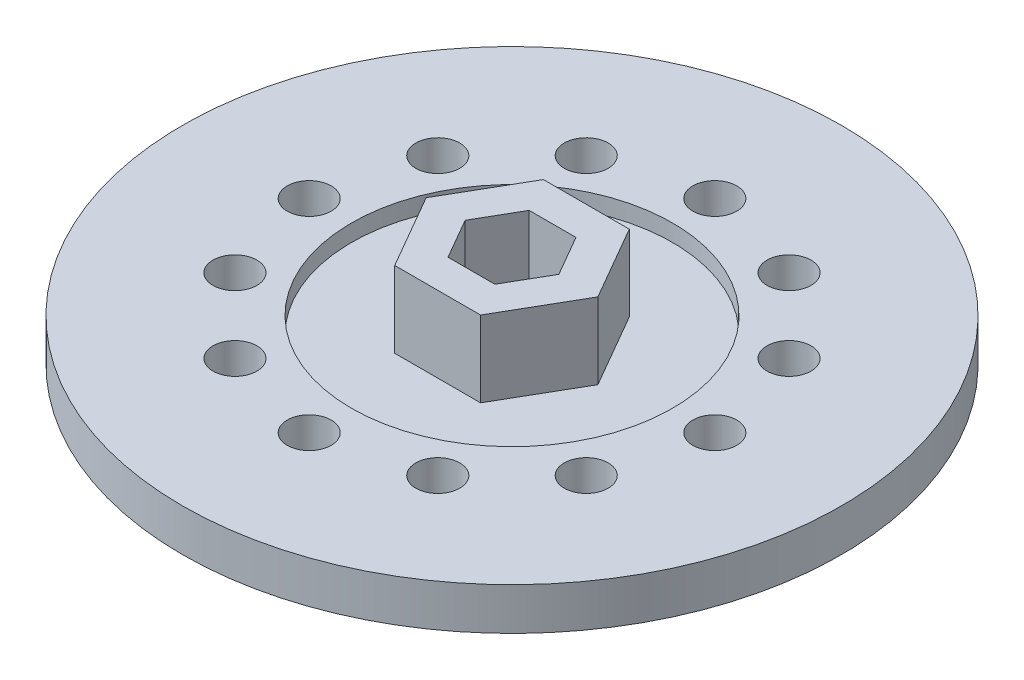
from build123d import *

# Parameters (mm, degrees)
SKETCH1_R           = 49.53
BOSS_EXTRUDE1_DEPTH = 15.24
HEX_HOLE_DEPTH      = 13.97
SKETCH5_R           = 4.191
CENTERHOLE_DEPTH    = 72.425504548
SKETCH6_R           = 39.37
CUT_EXTRUDE1_DEPTH  = 11.43
SKETCH7_R           = 3.302
CUT_EXTRUDE2_DEPTH  = 72.684722222
SKETCH8_R           = 49.53
SKETCH8_R_2         = 39.37
CUT_EXTRUDE3_DEPTH  = 11.43
SKETCH9_R           = 49.53
SKETCH9_R_2         = 24.13
SKETCH9_R_3         = 3.302
BOSS_EXTRUDE2_DEPTH = 2.54


with BuildPart() as part:
    # Sketch1 → Boss-Extrude1 (new body)
    with BuildSketch(Plane(origin=(0, 0, 0), x_dir=(1, 0, 0), z_dir=(0, 1, 0))):
        with Locations(Location((0, 0, 0), (0, 0, 90))):
            Circle(SKETCH1_R)
    extrude(amount=BOSS_EXTRUDE1_DEPTH)

    # Sketch4 → Hex hole (cut)
    with BuildSketch(Plane(origin=(0, 15.24, 0), x_dir=(1, 0, 0), z_dir=(0, 1, 0))):
        Polygon((-3.519527241, 6.096), (3.519527241, 6.096), (7.039054482, 0), (3.519527241, -6.096), (-3.519527241, -6.096), (-7.039054482, 0), align=None)
    extrude(amount=-HEX_HOLE_DEPTH, mode=Mode.SUBTRACT)

    # Sketch5 → Centerhole (cut, through all)
    with BuildSketch(Plane(origin=(0, 1.27, 0), x_dir=(1, 0, 0), z_dir=(0, 1, 0))):
        with Locations(Location((0, 0, 0), (0, 0, 270))):
            Circle(SKETCH5_R)
    extrude(amount=-CENTERHOLE_DEPTH, mode=Mode.SUBTRACT)

    # Sketch6 → Cut-Extrude1 (cut)
    with BuildSketch(Plane(origin=(0, 15.24, 0), x_dir=(1, 0, 0), z_dir=(0, 1, 0))):
        with Locations(Location((0, 0, 0), (0, 0, 270))):
            Circle(SKETCH6_R)
        Polygon((12.904933217, 0), (6.452466608, 11.176), (-6.452466608, 11.176), (-12.904933217, 0), (-6.452466608, -11.176), (6.452466608, -11.176), align=None, mode=Mode.SUBTRACT)
    extrude(amount=-CUT_EXTRUDE1_DEPTH, mode=Mode.SUBTRACT)

    # Sketch7 → Cut-Extrude2 (cut, through all)
    with BuildSketch(Plane.XZ):
        with Locations(Location((0, 30.48, 0), (0, 0, 270))):
            Circle(SKETCH7_R)
        with Locations(Location((15.24, 26.396454307, 0), (0, 0, 270))):
            Circle(SKETCH7_R)
        with Locations(Location((26.396454307, 15.24, 0), (0, 0, 270))):
            Circle(SKETCH7_R)
        with Locations(Location((30.48, 0, 0), (0, 0, 270))):
            Circle(SKETCH7_R)
        with Locations(Location((26.396454307, -15.24, 0), (0, 0, 270))):
            Circle(SKETCH7_R)
        with Locations(Location((15.24, -26.396454307, 0), (0, 0, 270))):
            Circle(SKETCH7_R)
        with Locations(Location((0, -30.48, 0), (0, 0, 270))):
            Circle(SKETCH7_R)
        with Locations(Location((-15.24, -26.396454307, 0), (0, 0, 270))):
            Circle(SKETCH7_R)
        with Locations(Location((-26.396454307, -15.24, 0), (0, 0, 270))):
            Circle(SKETCH7_R)
        with Locations(Location((-30.48, 0, 0), (0, 0, 270))):
            Circle(SKETCH7_R)
        with Locations(Location((-26.396454307, 15.24, 0), (0, 0, 270))):
            Circle(SKETCH7_R)
        with Locations(Location((-15.24, 26.396454307, 0), (0, 0, 270))):
            Circle(SKETCH7_R)
    extrude(amount=-CUT_EXTRUDE2_DEPTH, mode=Mode.SUBTRACT)

    # Sketch8 → Cut-Extrude3 (cut)
    with BuildSketch(Plane(origin=(0, 15.24, 0), x_dir=(1, 0, 0), z_dir=(0, 1, 0))):
        with Locations(Location((0, 0, 0), (0, 0, 90))):
            Circle(SKETCH8_R)
        Circle(SKETCH8_R_2, mode=Mode.SUBTRACT)
    extrude(amount=-CUT_EXTRUDE3_DEPTH, mode=Mode.SUBTRACT)

    # Sketch9 → Boss-Extrude2 (add)
    with BuildSketch(Plane(origin=(0, 3.81, 0), x_dir=(1, 0, 0), z_dir=(0, 1, 0))):
        with Locations(Location((0, 0, 0), (0, 0, 90))):
            Circle(SKETCH9_R)
        with Locations(Location((0, 0, 0), (0, 0, 270))):
            Circle(SKETCH9_R_2, mode=Mode.SUBTRACT)
        with Locations(Location((0, 30.48, 0), (0, 0, 90))):
            Circle(SKETCH9_R_3, mode=Mode.SUBTRACT)
        with Locations(Location((15.24, 26.396454307, 0), (0, 0, 90))):
            Circle(SKETCH9_R_3, mode=Mode.SUBTRACT)
        with Locations(Location((26.396454307, 15.24, 0), (0, 0, 90))):
            Circle(SKETCH9_R_3, mode=Mode.SUBTRACT)
        with Locations(Location((30.48, 0, 0), (0, 0, 90))):
            Circle(SKETCH9_R_3, mode=Mode.SUBTRACT)
        with Locations(Location((26.396454307, -15.24, 0), (0, 0, 90))):
            Circle(SKETCH9_R_3, mode=Mode.SUBTRACT)
        with Locations(Location((15.24, -26.396454307, 0), (0, 0, 90))):
            Circle(SKETCH9_R_3, mode=Mode.SUBTRACT)
        with Locations(Location((0, -30.48, 0), (0, 0, 90))):
            Circle(SKETCH9_R_3, mode=Mode.SUBTRACT)
        with Locations(Location((-15.24, -26.396454307, 0), (0, 0, 90))):
            Circle(SKETCH9_R_3, mode=Mode.SUBTRACT)
        with Locations(Location((-26.396454307, -15.24, 0), (0, 0, 90))):
            Circle(SKETCH9_R_3, mode=Mode.SUBTRACT)
        with Locations(Location((-30.48, 0, 0), (0, 0, 90))):
            Circle(SKETCH9_R_3, mode=Mode.SUBTRACT)
        with Locations(Location((-26.396454307, 15.24, 0), (0, 0, 90))):
            Circle(SKETCH9_R_3, mode=Mode.SUBTRACT)
        with Locations(Location((-15.24, 26.396454307, 0), (0, 0, 90))):
            Circle(SKETCH9_R_3, mode=Mode.SUBTRACT)
    extrude(amount=BOSS_EXTRUDE2_DEPTH)


solid = part.part
